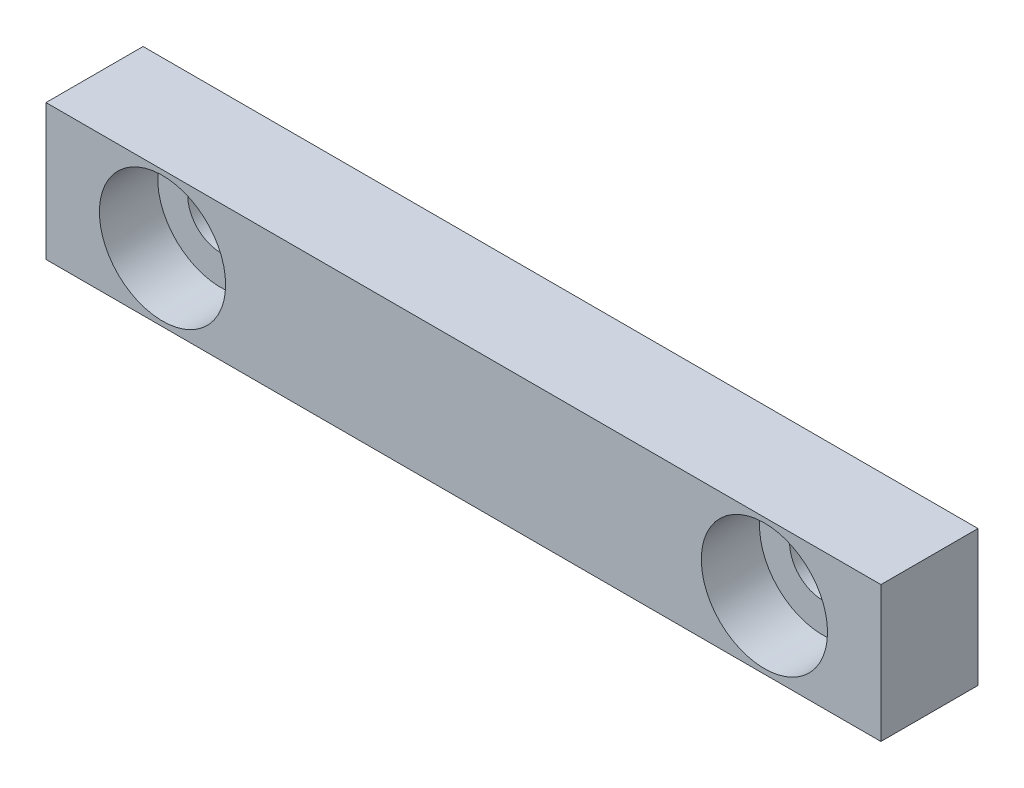
from build123d import *

# Parameters (mm, degrees)
SKETCH1_W                      = 43
SKETCH1_H                      = 7
BOSS_EXTRUDE1_DEPTH            = 5
CBORE_FOR_M3_SHCS1_D           = 3.4
CBORE_FOR_M3_SHCS1_CBORE_D     = 6.5
CBORE_FOR_M3_SHCS1_CBORE_DEPTH = 3


with BuildPart() as part:
    # Sketch1 → Boss-Extrude1 (new body)
    with BuildSketch(Plane.XY):
        with Locations((0, 3.5)):
            Rectangle(SKETCH1_W, SKETCH1_H)
    extrude(amount=BOSS_EXTRUDE1_DEPTH)

    # CBORE for M3 SHCS1 (through all)
    with Locations(Plane.XY.offset(5)):
        with Locations((-15.5, 3.5), (15.5, 3.5)):
            CounterBoreHole(CBORE_FOR_M3_SHCS1_D / 2, CBORE_FOR_M3_SHCS1_CBORE_D / 2, CBORE_FOR_M3_SHCS1_CBORE_DEPTH)


solid = part.part
